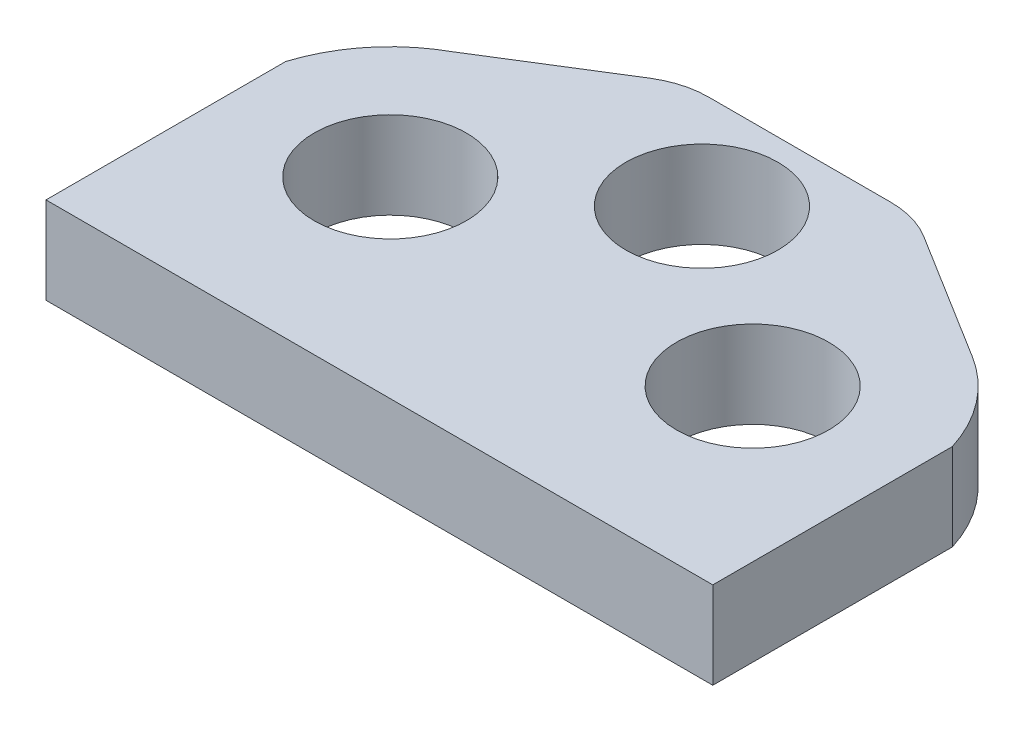
from build123d import *

# Parameters (mm, degrees)
SKETCH1_W           = 92
SKETCH1_H           = 56
BOSS_EXTRUDE1_DEPTH = 12
SKETCH8_W           = 92
SKETCH8_H           = 2
BOSS_EXTRUDE3_DEPTH = 12
CUT_EXTRUDE1_REACH  = 58.214
SKETCH2_R           = 10.5
CUT_EXTRUDE5_REACH  = 58.214
FILLET2_R           = 12
CUT_EXTRUDE7_REACH  = 58.214
SKETCH12_R          = 10.5


with BuildPart() as part:
    # Sketch1 → Boss-Extrude1 (new body)
    with BuildSketch(Plane(origin=(0, 0, 0), x_dir=(1, 0, 0), z_dir=(0, 1, 0))):
        Rectangle(SKETCH1_W, SKETCH1_H)
    extrude(amount=BOSS_EXTRUDE1_DEPTH)

    # Sketch8 → Boss-Extrude3 (add)
    with BuildSketch(Plane(origin=(0, 12, 0), x_dir=(1, 0, 0), z_dir=(0, 1, 0))):
        with Locations((0, 29)):
            Rectangle(SKETCH8_W, SKETCH8_H)
    extrude(amount=-BOSS_EXTRUDE3_DEPTH)

    # Sketch2 → Cut-Extrude1 (cut, up to next)
    with BuildSketch(Plane(origin=(0, 12, 0), x_dir=(1, 0, 0), z_dir=(0, 1, 0)), mode=Mode.PRIVATE) as cut_extrude1_sk1:
        with Locations(Location((-25, -1.5, 0), (0, 0, 270))):
            Circle(SKETCH2_R)
    cut_extrude1_tool1 = extrude(cut_extrude1_sk1.sketch, amount=-CUT_EXTRUDE1_REACH, mode=Mode.PRIVATE) & part.part
    # Sketch2 → Cut-Extrude1 (cut, up to next)
    with BuildSketch(Plane(origin=(0, 12, 0), x_dir=(1, 0, 0), z_dir=(0, 1, 0)), mode=Mode.PRIVATE) as cut_extrude1_sk2:
        with Locations(Location((25, -1.5, 0), (0, 0, 270))):
            Circle(SKETCH2_R)
    cut_extrude1_tool2 = extrude(cut_extrude1_sk2.sketch, amount=-CUT_EXTRUDE1_REACH, mode=Mode.PRIVATE) & part.part
    add(cut_extrude1_tool1.solids().sort_by_distance((-25, 12, 1.5))[0], mode=Mode.SUBTRACT)
    add(cut_extrude1_tool2.solids().sort_by_distance((25, 12, 1.5))[0], mode=Mode.SUBTRACT)

    # Sketch10 → Cut-Extrude5 (cut, up to next)
    with BuildSketch(Plane(origin=(0, 12, 0), x_dir=(1, 0, 0), z_dir=(0, 1, 0)), mode=Mode.PRIVATE) as cut_extrude5_sk1:
        with BuildLine():
            Line((-46, 5.057438524), (-46, 30))
            Line((-46, 30), (-16, 30))
            Line((-16, 30), (-35.667304108, 17.740806196))
            ThreePointArc((-35.667304108, 17.740806196), (-42.056420822, 12.395269294), (-46, 5.057438524))
        make_face()
    cut_extrude5_tool1 = extrude(cut_extrude5_sk1.sketch, amount=-CUT_EXTRUDE5_REACH, mode=Mode.PRIVATE) & part.part
    # Sketch10 → Cut-Extrude5 (cut, up to next)
    with BuildSketch(Plane(origin=(0, 12, 0), x_dir=(1, 0, 0), z_dir=(0, 1, 0)), mode=Mode.PRIVATE) as cut_extrude5_sk2:
        with BuildLine():
            Line((46, 5.057438524), (46, 30))
            Line((46, 30), (16, 30))
            Line((16, 30), (36.615382461, 17.183760068))
            ThreePointArc((36.615382461, 17.183760068), (42.39835371, 11.964668142), (46, 5.057438524))
        make_face()
    cut_extrude5_tool2 = extrude(cut_extrude5_sk2.sketch, amount=-CUT_EXTRUDE5_REACH, mode=Mode.PRIVATE) & part.part
    add(cut_extrude5_tool1.solids().sort_by_distance((-36.403407, 12, -23.114901))[0], mode=Mode.SUBTRACT)
    add(cut_extrude5_tool2.solids().sort_by_distance((36.411287, 12, -23.11647))[0], mode=Mode.SUBTRACT)

    # Fillet2
    fillet2_edges = [part.edges().sort_by_distance(p)[0] for p in [
        (-16, 6, -30),
        (16, 6, -30),
    ]]
    fillet(fillet2_edges, radius=FILLET2_R)

    # Sketch12 → Cut-Extrude7 (cut, up to next)
    with BuildSketch(Plane.XZ, mode=Mode.PRIVATE) as cut_extrude7_sk1:
        with Locations(Location((0, -16.5, 0), (0, 0, 270))):
            Circle(SKETCH12_R)
    cut_extrude7_tool1 = extrude(cut_extrude7_sk1.sketch, amount=-CUT_EXTRUDE7_REACH, mode=Mode.PRIVATE) & part.part
    add(cut_extrude7_tool1.solids().sort_by_distance((0, 0, -16.5))[0], mode=Mode.SUBTRACT)


solid = part.part
